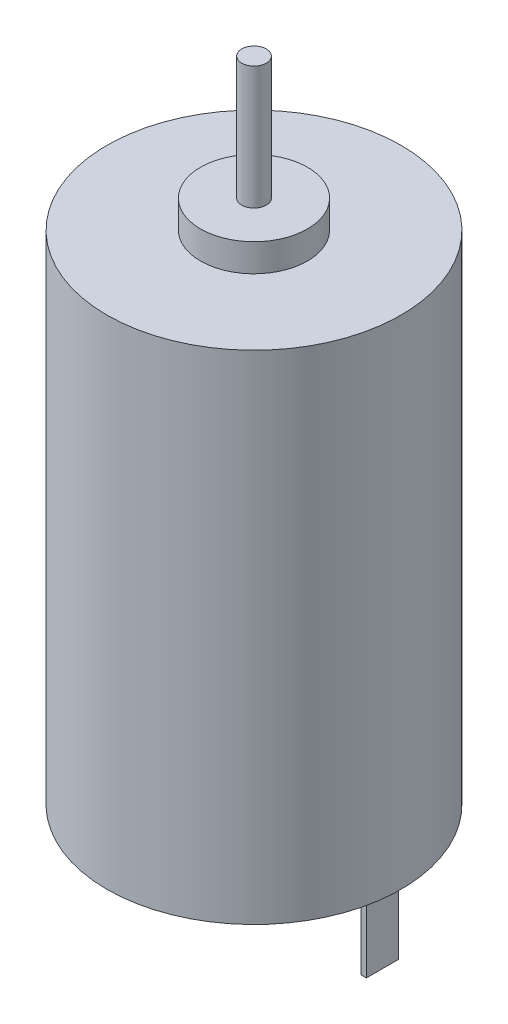
from build123d import *

# Parameters (mm, degrees)
SKETCH1_R             = 13.75
BOSS_EXTRUDE1_DEPTH   = 46.5
SKETCH2_R             = 5
BOSS_EXTRUDE2_DEPTH   = 2.6
SKETCH3_W             = 0.5
SKETCH3_H             = 3
BOSS_EXTRUDE3_DEPTH   = 7.3
BOSS_EXTRUDE3_2_DEPTH = 7.3
BOSS_EXTRUDE4_START   = 2.6
SKETCH4_R             = 5
BOSS_EXTRUDE4_DEPTH   = 2.6
SKETCH5_R             = 1.15
BOSS_EXTRUDE5_DEPTH   = 11.5


with BuildPart() as part:
    # Sketch1 → Boss-Extrude1 (new body)
    with BuildSketch(Plane(origin=(0, 0, 0), x_dir=(1, 0, 0), z_dir=(0, 1, 0))):
        with Locations(Location((0, 0, 0), (0, 0, 90))):
            Circle(SKETCH1_R)
    extrude(amount=BOSS_EXTRUDE1_DEPTH)

    # Sketch2 → Boss-Extrude2 (add)
    with BuildSketch(Plane.XZ):
        with Locations(Location((0, 0, 0), (0, 0, 270))):
            Circle(SKETCH2_R)
    extrude(amount=BOSS_EXTRUDE2_DEPTH)

    # Sketch4 → Boss-Extrude4 (add)
    with BuildSketch(Plane(origin=(0, 46.5, 0), x_dir=(1, 0, 0), z_dir=(0, 1, 0)).offset(BOSS_EXTRUDE4_START)):
        with Locations(Location((0, 0, 0), (0, 0, 90))):
            Circle(SKETCH4_R)
    extrude(amount=-BOSS_EXTRUDE4_DEPTH)


with BuildPart() as body_2:
    # Sketch3 → Boss-Extrude3 (new body)
    with BuildSketch(Plane.XZ):
        with Locations((-11.75, 0)):
            Rectangle(SKETCH3_W, SKETCH3_H)
    extrude(amount=BOSS_EXTRUDE3_DEPTH)


with BuildPart() as body_3:
    # Sketch3 → Boss-Extrude3 2 (new body)
    with BuildSketch(Plane.XZ):
        with Locations((11.75, 0)):
            Rectangle(SKETCH3_W, SKETCH3_H)
    extrude(amount=BOSS_EXTRUDE3_2_DEPTH)


with BuildPart() as body_4:
    # Sketch5 → Boss-Extrude5 (new body)
    with BuildSketch(Plane(origin=(0, 49.1, 0), x_dir=(1, 0, 0), z_dir=(0, 1, 0))):
        with Locations(Location((0, 0, 0), (0, 0, 270))):
            Circle(SKETCH5_R)
    extrude(amount=BOSS_EXTRUDE5_DEPTH)


solid = Compound([part.part, body_2.part, body_3.part, body_4.part])
